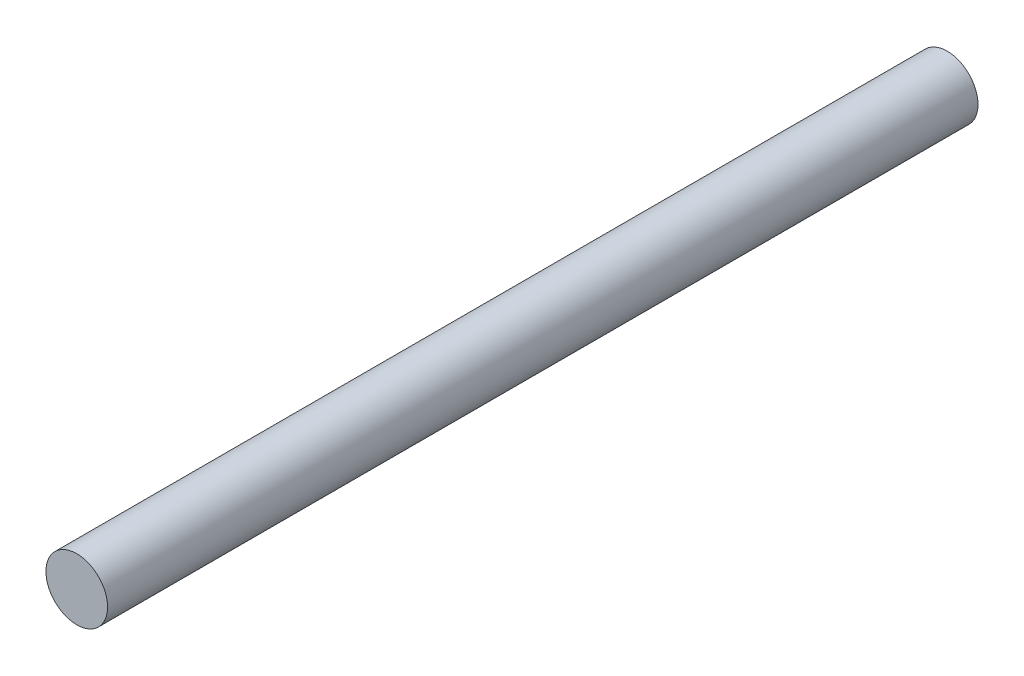
from build123d import *

# Parameters (mm, degrees)
CROQUIS1_R              = 4
SALIENTE_EXTRUIR1_DEPTH = 56.5


with BuildPart() as part:
    # Croquis1 → Saliente-Extruir1 (new, symmetric)
    with BuildSketch(Plane.XY):
        Circle(CROQUIS1_R)
    extrude(amount=SALIENTE_EXTRUIR1_DEPTH, both=True)


solid = part.part
